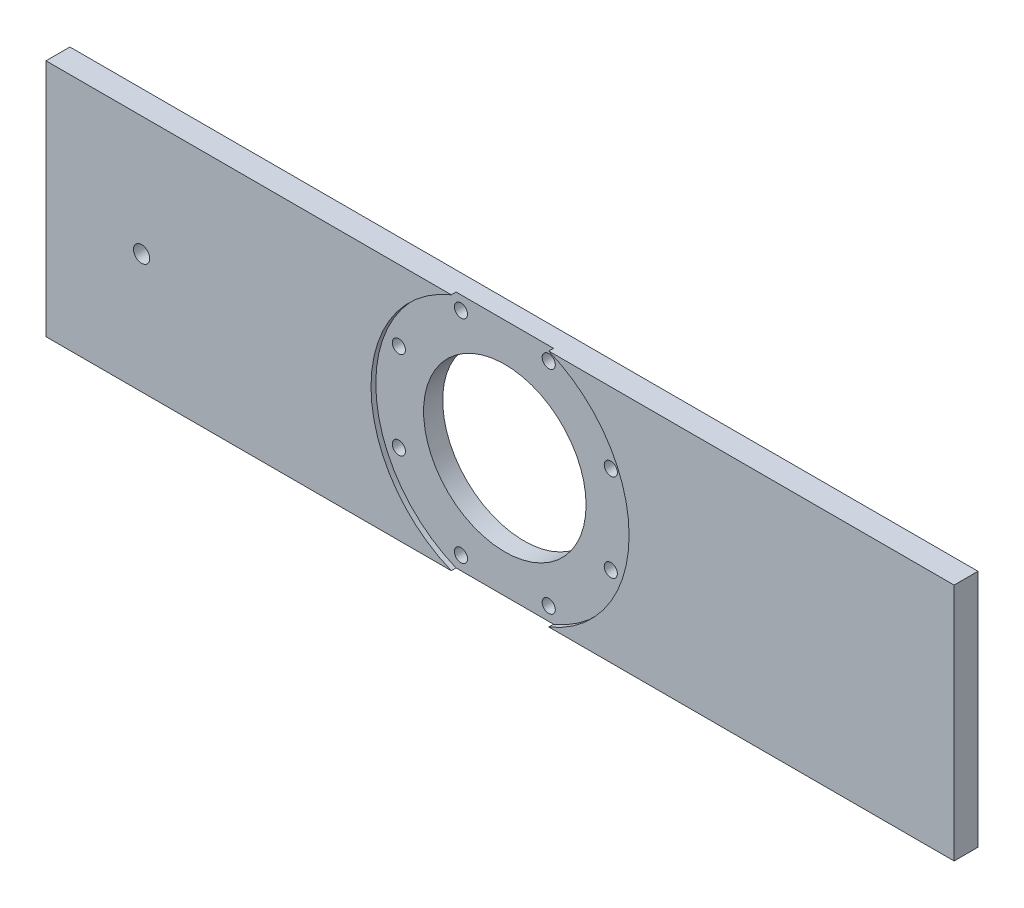
from build123d import *

# Parameters (mm, degrees)
SCHIZZO1_W                   = 380
SCHIZZO1_H                   = 100
ESTRUSIONE_ESTRUSIONE1_DEPTH = 10
SCHIZZO2_R                   = 54
TAGLIO_ESTRUSIONE1_DEPTH     = 2
SCHIZZO3_R                   = 2.75
TAGLIO_ESTRUSIONE2_DEPTH     = 197.631635298
RIPETIZIONECIRCOLARE1_COUNT  = 8
SCHIZZO4_R                   = 34
TAGLIO_ESTRUSIONE3_DEPTH     = 197.631635298
SCHIZZO5_R                   = 3.4
TAGLIO_ESTRUSIONE4_DEPTH     = 197.723155729


with BuildPart() as part:
    # Schizzo1 → Estrusione-Estrusione1 (new body)
    with BuildSketch(Plane.XY):
        Rectangle(SCHIZZO1_W, SCHIZZO1_H)
    extrude(amount=ESTRUSIONE_ESTRUSIONE1_DEPTH)

    # Schizzo2 → Taglio-Estrusione1 (cut)
    with BuildSketch(Plane.XY.offset(10)):
        Circle(SCHIZZO2_R)
    extrude(amount=-TAGLIO_ESTRUSIONE1_DEPTH, mode=Mode.SUBTRACT)

    # Schizzo3 → Taglio-Estrusione2 (cut, through all)
    with BuildSketch(Plane.XY.offset(8)):
        with Locations((-44.346217561, -18.368804754)):
            Circle(SCHIZZO3_R)
    taglio_estrusione2 = extrude(amount=-TAGLIO_ESTRUSIONE2_DEPTH, mode=Mode.SUBTRACT)

    # RipetizioneCircolare1: Taglio-Estrusione2 ×8 about axis
    ripetizionecircolare1_axis = Axis((0, 0, 0), (0, 0, 1))
    for i in range(1, RIPETIZIONECIRCOLARE1_COUNT):
        add(taglio_estrusione2.rotate(ripetizionecircolare1_axis, i * 360 / RIPETIZIONECIRCOLARE1_COUNT), mode=Mode.SUBTRACT)

    # Schizzo4 → Taglio-Estrusione3 (cut, through all)
    with BuildSketch(Plane.XY.offset(8)):
        Circle(SCHIZZO4_R)
    extrude(amount=-TAGLIO_ESTRUSIONE3_DEPTH, mode=Mode.SUBTRACT)

    # Schizzo5 → Taglio-Estrusione4 (cut, through all)
    with BuildSketch(Plane.XY.offset(10)):
        with Locations((-150, 0)):
            Circle(SCHIZZO5_R)
    extrude(amount=-TAGLIO_ESTRUSIONE4_DEPTH, mode=Mode.SUBTRACT)


solid = part.part
